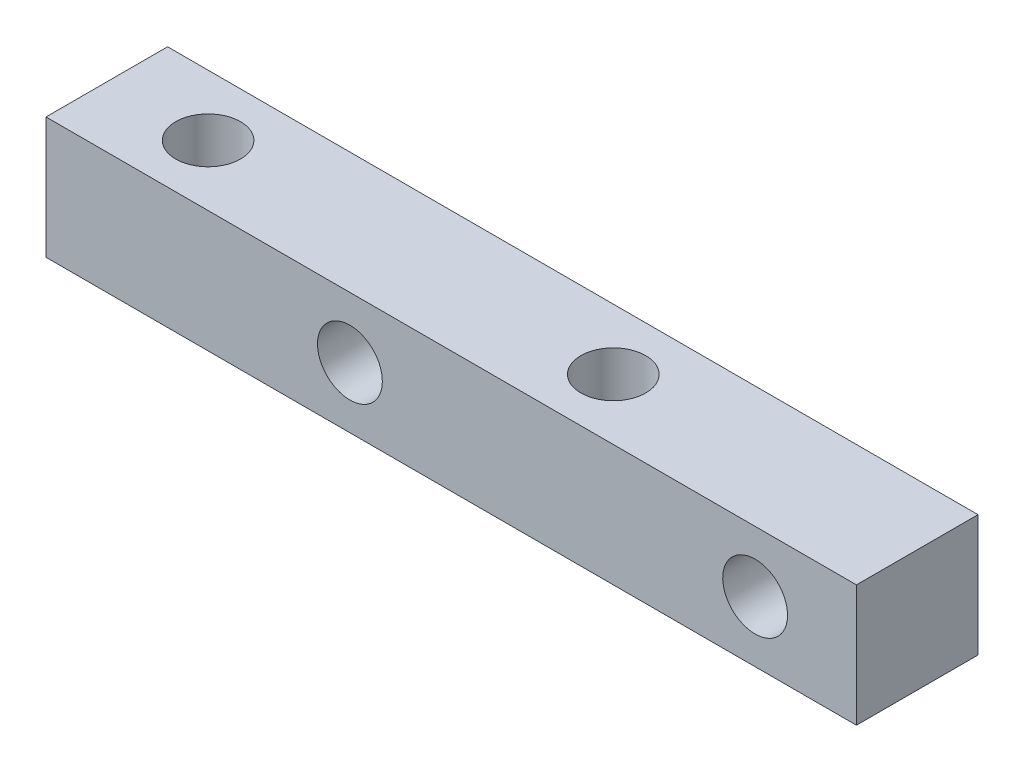
from build123d import *

# Parameters (mm, degrees)
SKETCH_1_W          = 6
SKETCH_1_H          = 6
EXTRUDE_1_DEPTH     = 40
SKETCH_2_R          = 1.6
CUT_EXTRUDE_1_DEPTH = 41.558599581
SKETCH_3_R          = 1.6
CUT_EXTRUDE_2_DEPTH = 41.558599581


with BuildPart() as part:
    # 草图1 → 凸台-拉伸1 (new body)
    with BuildSketch(Plane(origin=(0, 0, 0), x_dir=(0, 0, -1), z_dir=(1, 0, 0))):
        Rectangle(SKETCH_1_W, SKETCH_1_H)
    extrude(amount=EXTRUDE_1_DEPTH)

    # 草图2 → 切除-拉伸1 (cut, through all)
    with BuildSketch(Plane(origin=(0, 0, -3), x_dir=(-1, 0, 0), z_dir=(0, 0, -1))):
        with Locations(Location((-35, 0, 0), (0, 0, 90))):
            Circle(SKETCH_2_R)
        with Locations(Location((-15, 0, 0), (0, 0, 90))):
            Circle(SKETCH_2_R)
    extrude(amount=-CUT_EXTRUDE_1_DEPTH, mode=Mode.SUBTRACT)

    # 草图3 → 切除-拉伸2 (cut, through all)
    with BuildSketch(Plane(origin=(0, 3, 0), x_dir=(1, 0, 0), z_dir=(0, 1, 0))):
        with Locations(Location((5, 0, 0), (0, 0, 270))):
            Circle(SKETCH_3_R)
        with Locations(Location((25, 0, 0), (0, 0, 270))):
            Circle(SKETCH_3_R)
    extrude(amount=-CUT_EXTRUDE_2_DEPTH, mode=Mode.SUBTRACT)


solid = part.part
